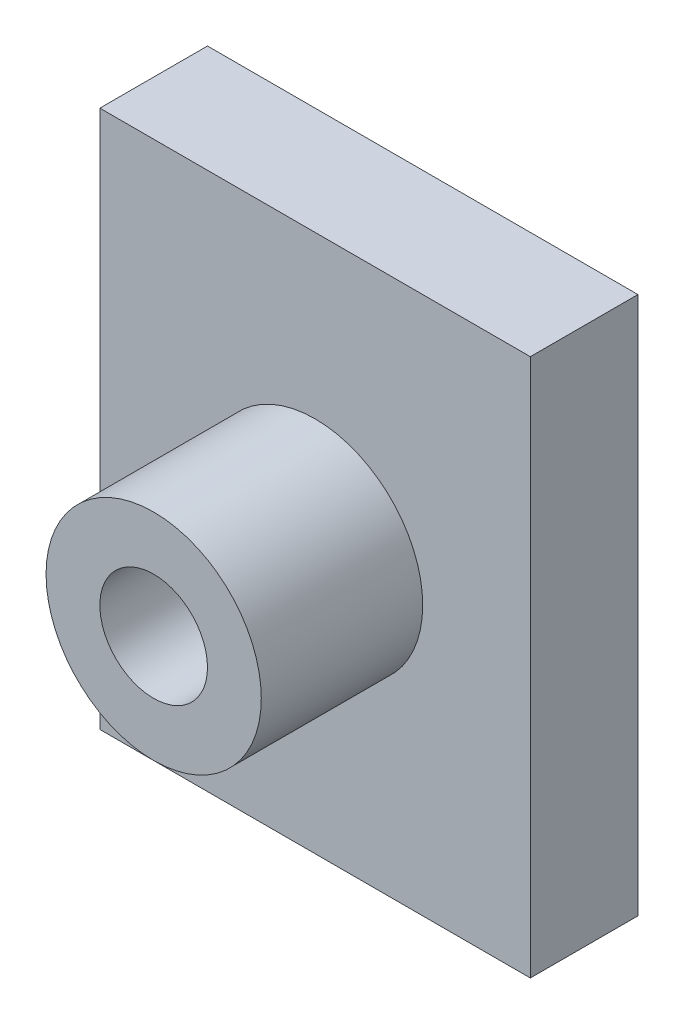
from build123d import *

# Parameters (mm, degrees)
ESQUISSE1_W             = 80
ESQUISSE1_H             = 100
BOSS_EXTRU_1_DEPTH      = 20
ESQUISSE2_R             = 20
BOSS_EXTRU_2_DEPTH      = 30
ESQUISSE3_R             = 10
ENL_V_MAT_EXTRU_1_DEPTH = 82.240384046


with BuildPart() as part:
    # Esquisse1 → Boss.-Extru.1 (new body)
    with BuildSketch(Plane.XY):
        Rectangle(ESQUISSE1_W, ESQUISSE1_H)
    extrude(amount=BOSS_EXTRU_1_DEPTH)

    # Esquisse2 → Boss.-Extru.2 (add)
    with BuildSketch(Plane.XY.offset(20)):
        Circle(ESQUISSE2_R)
    extrude(amount=BOSS_EXTRU_2_DEPTH)

    # Esquisse3 → Enlèv. mat.-Extru.1 (cut, through all)
    with BuildSketch(Plane.XY.offset(50)):
        Circle(ESQUISSE3_R)
    extrude(amount=-ENL_V_MAT_EXTRU_1_DEPTH, mode=Mode.SUBTRACT)


solid = part.part
